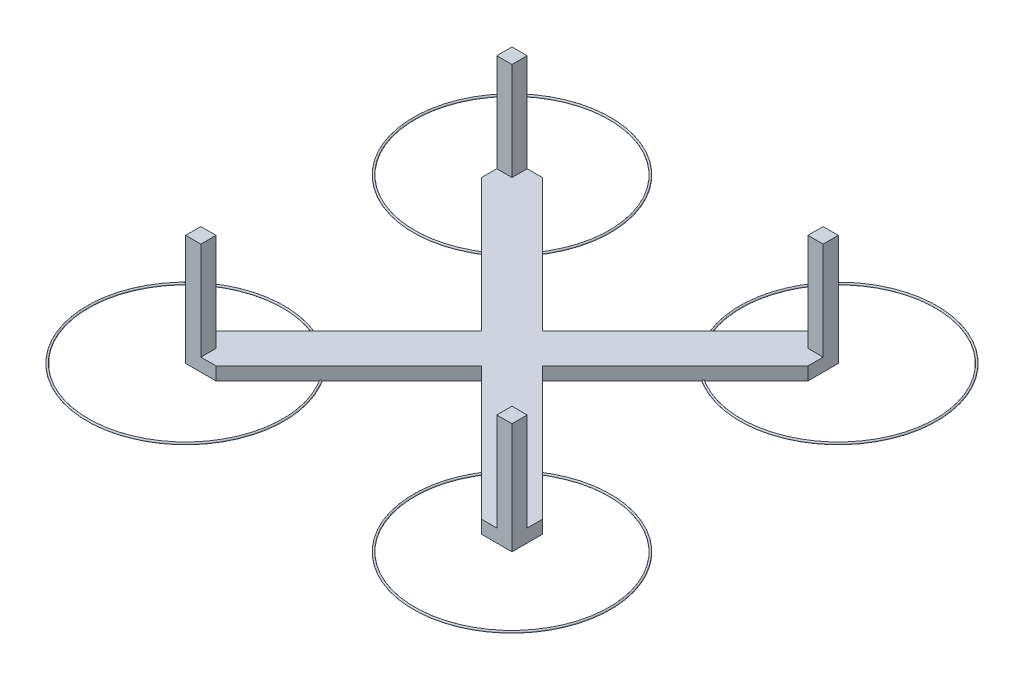
from build123d import *

# Parameters (mm, degrees)
BOSS_EXTRUDE1_DEPTH = 5.08
SKETCH3_W           = 5.918366974
SKETCH3_H           = 5.918366974
BOSS_EXTRUDE2_DEPTH = 38.1
SWEEP11_PROFILE_R   = 0.381
CIRPATTERN1_COUNT   = 4


with BuildPart() as part:
    # Sketch1 → Boss-Extrude1 (new body)
    with BuildSketch(Plane(origin=(0, 0, 0), x_dir=(1, 0, 0), z_dir=(0, 1, 0))):
        Polygon((-11.836733948, 0), (-63.5, 51.663266052), (-63.5, 63.5), (-51.663266052, 63.5), (0, 11.836733948), (51.663266052, 63.5), (63.5, 63.5), (63.5, 51.663266052), (11.836733948, 0), (63.5, -51.663266052), (63.5, -63.5), (51.663266052, -63.5), (0, -11.836733948), (-51.663266052, -63.5), (-63.5, -63.5), (-63.5, -51.663266052), align=None)
    extrude(amount=BOSS_EXTRUDE1_DEPTH)

    # Sketch3 → Boss-Extrude2 (add)
    with BuildSketch(Plane(origin=(0, 5.08, 0), x_dir=(1, 0, 0), z_dir=(0, 1, 0))):
        with Locations((-60.540816513, -60.540816513)):
            Rectangle(SKETCH3_W, SKETCH3_H)
        with Locations((60.540816513, 60.540816513)):
            Rectangle(SKETCH3_W, SKETCH3_H)
        with Locations((-60.540816513, 60.540816513)):
            Rectangle(SKETCH3_W, SKETCH3_H)
        with Locations((60.540816513, -60.540816513)):
            Rectangle(SKETCH3_W, SKETCH3_H)
    extrude(amount=BOSS_EXTRUDE2_DEPTH)

    # Sweep11: sweep along a path in Sketch4
    with BuildLine(Plane.XZ) as sweep11_path:
        CenterArc((-63.5, 63.5), 38.1, 0, 360)
    # Sweep11 profile (on start of the path) → Sweep11 (sweep)
    with BuildSketch(Plane(origin=(-25.4, 0, 63.5), x_dir=(1, 0, 0), z_dir=(0, 0, 1))):
        Circle(SWEEP11_PROFILE_R)
    sweep11 = sweep(path=sweep11_path.line)

    # CirPattern1: Sweep11 ×4 about axis
    cirpattern1_axis = Axis((0, 0, 0), (0, 1, 0))
    for i in range(1, CIRPATTERN1_COUNT):
        add(sweep11.rotate(cirpattern1_axis, i * 360 / CIRPATTERN1_COUNT))


solid = part.part
